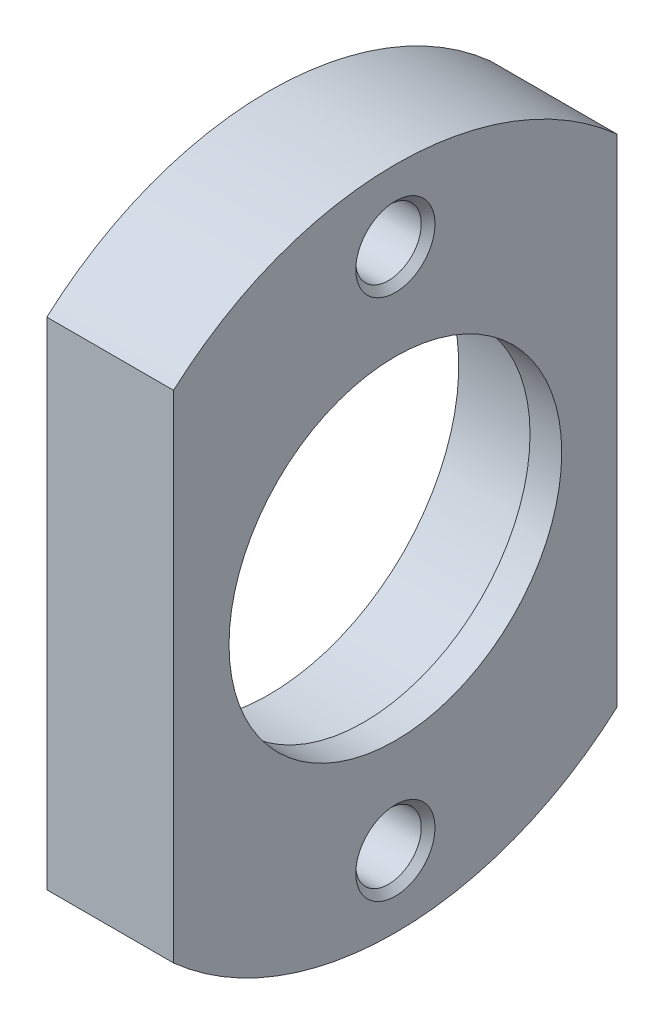
from build123d import *

# Parameters (mm, degrees)
BOSS_EXTRUDE1_DEPTH      = 4
BOSS_EXTRUDE1_DEPTH_BACK = 4


with BuildPart() as part:
    # Sketch1 → Boss-Extrude1 (new, two sides: drawn at the far end of the back side and taken through both)
    with BuildSketch(Plane(origin=(0, 0, 0), x_dir=(0, 0, -1), z_dir=(1, 0, 0)).offset(-BOSS_EXTRUDE1_DEPTH_BACK)):
        with BuildLine():
            Line((14, -15.652475842), (14, 15.652475842))
            ThreePointArc((14, 15.652475842), (0, 21), (-14, 15.652475842))
            Line((-14, 15.652475842), (-14, -15.652475842))
            ThreePointArc((-14, -15.652475842), (0, -21), (14, -15.652475842))
        make_face()
    extrude(amount=BOSS_EXTRUDE1_DEPTH + BOSS_EXTRUDE1_DEPTH_BACK)

    # Sketch2 → Cut-Revolve1 (revolve, cut)
    with BuildSketch(Plane.XY):
        Polygon((-4, 0), (-4, 12), (2, 12), (2, 10.5), (4, 10.5), (4, 0), align=None)
    revolve(axis=Axis((4, 0, 0), (-1, 0, 0)), mode=Mode.SUBTRACT)

    # Sketch3 → Cut-Revolve2 (revolve, cut)
    with BuildSketch(Plane.XY):
        Polygon((-4, -16.5), (-4, -14), (-3.567, -14.433), (3.567, -14.433), (4, -14), (4, -16.5), align=None)
    revolve(axis=Axis((4, -16.5, 0), (-1, 0, 0)), mode=Mode.SUBTRACT)

    # Sketch4 → Cut-Revolve3 (revolve, cut)
    with BuildSketch(Plane.XY):
        Polygon((-4, 16.5), (-4, 19), (-3.567, 18.567), (3.567, 18.567), (4, 19), (4, 16.5), align=None)
    revolve(axis=Axis((4, 16.5, 0), (-1, 0, 0)), mode=Mode.SUBTRACT)


solid = part.part
